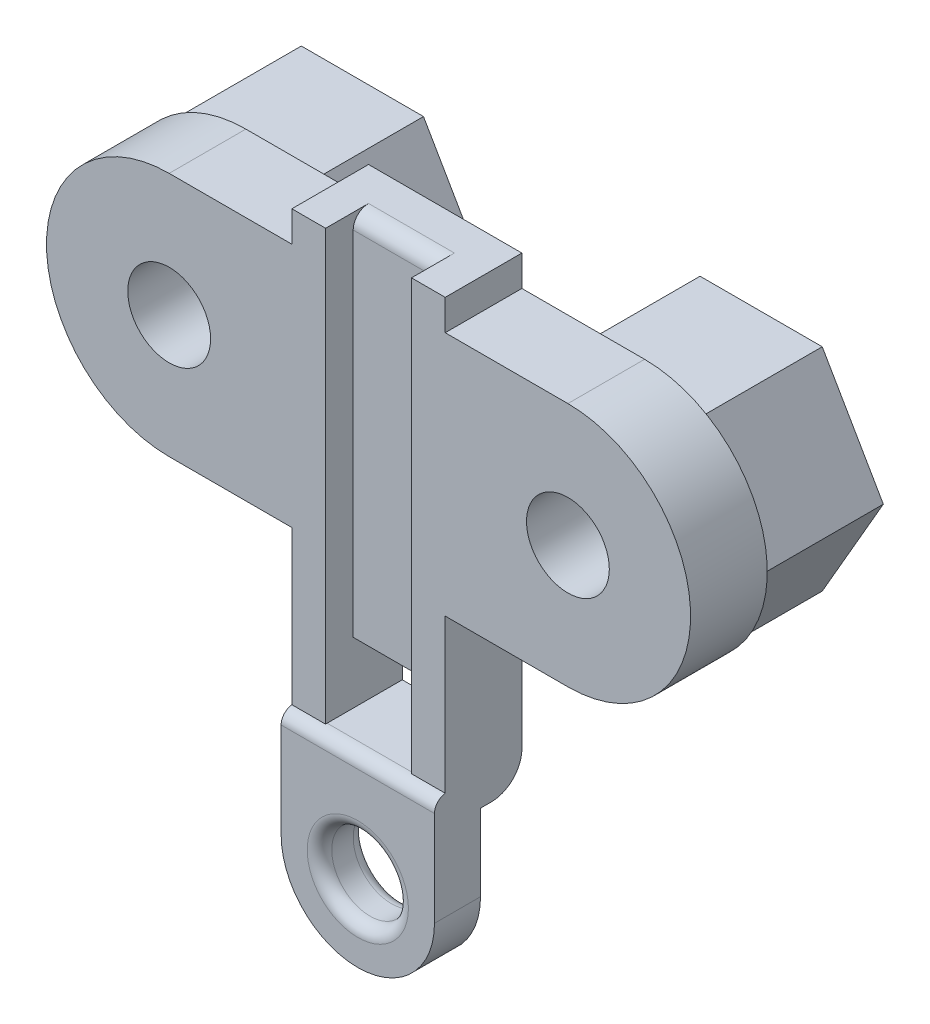
from build123d import *

# Parameters (mm, degrees)
SKETCH_1_W                    = 5
SKETCH_1_H                    = 10
EXTRUDE_297_DEPTH             = 2.5
SKETCH_2_W                    = 2.5
SKETCH_2_H                    = 8
EXTRUDE_2_DEPTH               = 8
HOLE_WIZARD_M2_5_2_D          = 2.7
EXTRUDE_1_DEPTH               = 3.8
FILLET_1_RADIUS               = 4
FILLET_1_LENGTH               = 2.5
FILLET_1_OF_MIRROR_1_2_RADIUS = 4
FILLET_1_OF_MIRROR_1_2_LENGTH = 2.5
SKETCH_13_W                   = 5
SKETCH_13_H                   = 2.5
EXTRUDE_3_DEPTH               = 5
SKETCH_15_W                   = 2.8
SKETCH_15_H                   = 14
CUT_EXTRUDE_2383_DEPTH        = 0.9
FILLET_2_R                    = 0.5
SKETCH_16_W                   = 5
SKETCH_16_H                   = 1
EXTRUDE_4_DEPTH               = 0.35
SKETCH_17_W                   = 5
SKETCH_17_H                   = 1.5
EXTRUDE_5_DEPTH               = 5
CUT_EXTRUDE_1_REACH           = 21.02
SKETCH_18_R                   = 1.25
FILLET_3_RADIUS               = 2.5
FILLET_3_LENGTH               = 1.5
FILLET_4_R                    = 0.4
FILLET_5_R                    = 1
CUT_EXTRUDE_2_REACH           = 21.09
SKETCH_19_W                   = 2.8
SKETCH_19_H                   = 2


with BuildPart() as part:
    # 草图1 → Extrude 297 (new body)
    with BuildSketch(Plane.XY):
        Rectangle(SKETCH_1_W, SKETCH_1_H)
    extrude(amount=EXTRUDE_297_DEPTH)

    # 草图2 → 凸台-拉伸2 (add)
    with BuildSketch(Plane(origin=(2.5, 0, 0), x_dir=(0, 0, -1), z_dir=(1, 0, 0))):
        with Locations((-1.25, 0)):
            Rectangle(SKETCH_2_W, SKETCH_2_H)
    extrude_2 = extrude(amount=EXTRUDE_2_DEPTH)

    # M2.5 间隙孔2 (through all)
    with Locations(Plane.XY.offset(2.5)):
        with Locations((6.5, 0)):
            hole_wizard_m2_5_2 = Hole(HOLE_WIZARD_M2_5_2_D / 2)

    # 草图11 → 拉伸-薄壁1 (add)
    with BuildSketch(Plane(origin=(0, 0, 0), x_dir=(-1, 0, 0), z_dir=(0, 0, -1))):
        Polygon((-4.508141571, 3.45), (-8.491858429, 3.45), (-10.483716857, 0), (-8.491858429, -3.45), (-4.508141571, -3.45), (-2.516283143, 0), align=None)
        Polygon((-4.970021787, 2.65), (-8.029978213, 2.65), (-9.559956427, 0), (-8.029978213, -2.65), (-4.970021787, -2.65), (-3.440043573, 0), align=None, mode=Mode.SUBTRACT)
    extrude_1 = extrude(amount=EXTRUDE_1_DEPTH)

    # 圆角1: full round fillet: the end face becomes a half cylinder, R = half its width
    fillet_1_face = Plane((10.5, 0, 1.25), x_dir=(0, 0, 1), z_dir=(1, 0, 0))  # on the end face: x along it, z out of the body
    fillet_1_slab = fillet_1_face.offset(-FILLET_1_RADIUS / 2) * Box(FILLET_1_LENGTH, 2 * FILLET_1_RADIUS, FILLET_1_RADIUS, mode=Mode.PRIVATE)  # the body's end, R deep
    fillet_1_round = Plane((6.5, 0, 1.25), x_dir=(1, 0, 0), z_dir=(0, 0, 1)) * Cylinder(FILLET_1_RADIUS, FILLET_1_LENGTH, mode=Mode.PRIVATE)  # its axis R under the face
    add(fillet_1_slab - fillet_1_round, mode=Mode.SUBTRACT)

    # 镜向1: 凸台-拉伸2, M2.5 间隙孔2, 拉伸-薄壁1 across plane
    add(extrude_2.mirror(Plane(origin=(0, 0, 0), x_dir=(0, 0, 1), z_dir=(1, 0, 0))))
    add(hole_wizard_m2_5_2.mirror(Plane(origin=(0, 0, 0), x_dir=(0, 0, 1), z_dir=(1, 0, 0))), mode=Mode.SUBTRACT)
    add(extrude_1.mirror(Plane(origin=(0, 0, 0), x_dir=(0, 0, 1), z_dir=(1, 0, 0))))

    # 圆角1 of Mirror 1 2: full round fillet: the end face becomes a half cylinder, R = half its width
    fillet_1_of_mirror_1_2_face = Plane((-10.5, 0, 1.25), x_dir=(0, 0, 1), z_dir=(-1, 0, 0))  # on the end face: x along it, z out of the body
    fillet_1_of_mirror_1_2_slab = fillet_1_of_mirror_1_2_face.offset(-FILLET_1_OF_MIRROR_1_2_RADIUS / 2) * Box(FILLET_1_OF_MIRROR_1_2_LENGTH, 2 * FILLET_1_OF_MIRROR_1_2_RADIUS, FILLET_1_OF_MIRROR_1_2_RADIUS, mode=Mode.PRIVATE)  # the body's end, R deep
    fillet_1_of_mirror_1_2_round = Plane((-6.5, 0, 1.25), x_dir=(-1, 0, 0), z_dir=(0, 0, 1)) * Cylinder(FILLET_1_OF_MIRROR_1_2_RADIUS, FILLET_1_OF_MIRROR_1_2_LENGTH, mode=Mode.PRIVATE)  # its axis R under the face
    add(fillet_1_of_mirror_1_2_slab - fillet_1_of_mirror_1_2_round, mode=Mode.SUBTRACT)

    # 草图13 → 凸台-拉伸3 (add)
    with BuildSketch(Plane.XZ.offset(5)):
        with Locations((0, 1.25)):
            Rectangle(SKETCH_13_W, SKETCH_13_H)
    extrude(amount=EXTRUDE_3_DEPTH)

    # 草图15 → Cut-Extrude 2383 (cut)
    with BuildSketch(Plane.XY.offset(2.5)):
        with Locations((0, -2)):
            Rectangle(SKETCH_15_W, SKETCH_15_H)
    extrude(amount=-CUT_EXTRUDE_2383_DEPTH, mode=Mode.SUBTRACT)

    # 圆角2
    fillet_2_edges = [part.edges().sort_by_distance(p)[0] for p in [
        (0, 5, 1.6),
    ]]
    fillet(fillet_2_edges, radius=FILLET_2_R)

    # 草图16 → 凸台-拉伸4 (add)
    with BuildSketch(Plane.XY.offset(2.5)):
        with Locations((0, -9.5)):
            Rectangle(SKETCH_16_W, SKETCH_16_H)
    extrude(amount=EXTRUDE_4_DEPTH)

    # 草图17 → 凸台-拉伸5 (add)
    with BuildSketch(Plane.XZ.offset(10)):
        with Locations((0, 2.1)):
            Rectangle(SKETCH_17_W, SKETCH_17_H)
    extrude(amount=EXTRUDE_5_DEPTH)

    # 草图18 → 切除-拉伸1 (cut, up to next)
    with BuildSketch(Plane(origin=(0, 0, 1.35), x_dir=(-1, 0, 0), z_dir=(0, 0, -1)), mode=Mode.PRIVATE) as cut_extrude_1_sk1:
        with Locations((0, -12.5)):
            Circle(SKETCH_18_R)
    cut_extrude_1_tool1 = extrude(cut_extrude_1_sk1.sketch, amount=-CUT_EXTRUDE_1_REACH, mode=Mode.PRIVATE) & part.part
    add(cut_extrude_1_tool1.solids().sort_by_distance((0, -12.5, 1.35))[0], mode=Mode.SUBTRACT)

    # 圆角3: full round fillet: the end face becomes a half cylinder, R = half its width
    fillet_3_face = Plane((0, -15, 2.1), x_dir=(0, 0, -1), z_dir=(0, -1, 0))  # on the end face: x along it, z out of the body
    fillet_3_slab = fillet_3_face.offset(-FILLET_3_RADIUS / 2) * Box(FILLET_3_LENGTH, 2 * FILLET_3_RADIUS, FILLET_3_RADIUS, mode=Mode.PRIVATE)  # the body's end, R deep
    fillet_3_round = Plane((0, -12.5, 2.1), x_dir=(0, -1, 0), z_dir=(0, 0, -1)) * Cylinder(FILLET_3_RADIUS, FILLET_3_LENGTH, mode=Mode.PRIVATE)  # its axis R under the face
    add(fillet_3_slab - fillet_3_round, mode=Mode.SUBTRACT)

    # 圆角4
    fillet_4_edges = [part.edges().sort_by_distance(p)[0] for p in [
        (1.25, -12.5, 2.85),
        (1.25, -12.5, 1.35),
        (0, -9, 2.85),
    ]]
    fillet(fillet_4_edges, radius=FILLET_4_R)

    # 圆角5
    fillet_5_edges = [part.edges().sort_by_distance(p)[0] for p in [
        (0, -10, 0),
    ]]
    fillet(fillet_5_edges, radius=FILLET_5_R)

    # 草图19 → 切除-拉伸2 (cut, up to next)
    with BuildSketch(Plane.XY.offset(1.6), mode=Mode.PRIVATE) as cut_extrude_2_sk1:
        with Locations((0, -8)):
            Rectangle(SKETCH_19_W, SKETCH_19_H)
    cut_extrude_2_tool1 = extrude(cut_extrude_2_sk1.sketch, amount=-CUT_EXTRUDE_2_REACH, mode=Mode.PRIVATE) & part.part
    add(cut_extrude_2_tool1.solids().sort_by_distance((0, -8, 1.6))[0], mode=Mode.SUBTRACT)


solid = part.part
